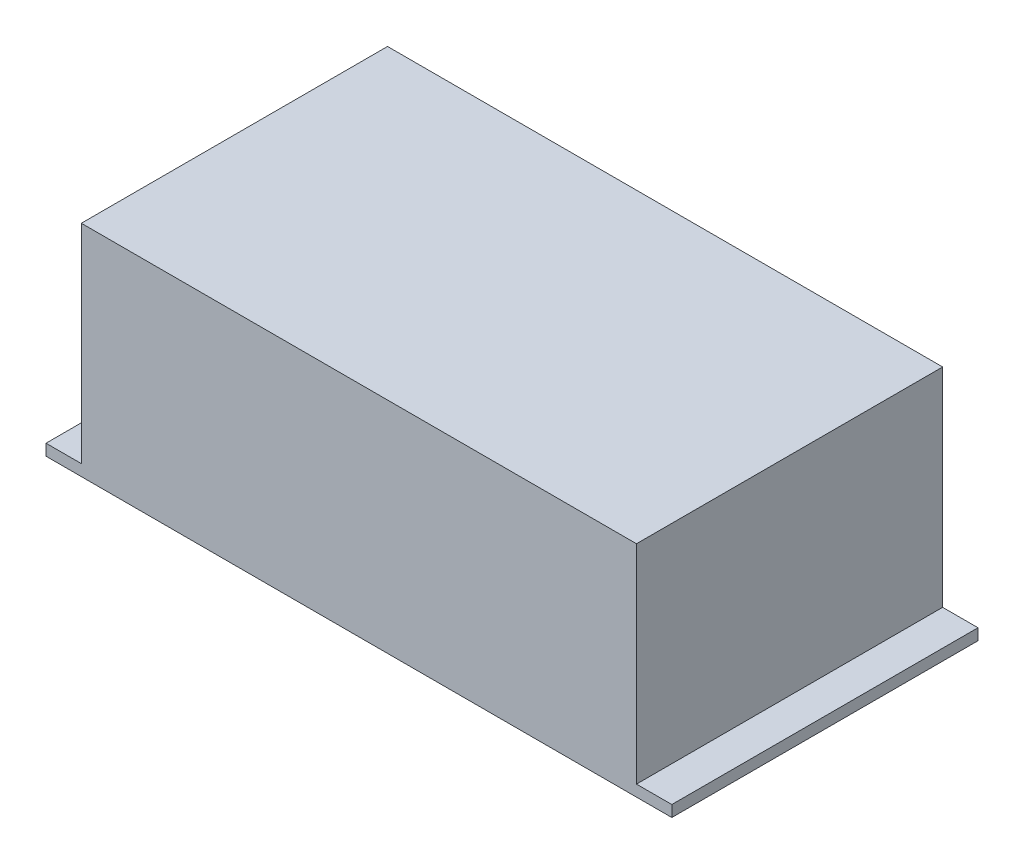
from build123d import *

# Parameters (mm, degrees)
SKETCH1_W           = 72.15
SKETCH1_H           = 35.3
BOSS_EXTRUDE1_DEPTH = 1.3
SKETCH2_W           = 64
SKETCH2_H           = 35.3
BOSS_EXTRUDE2_DEPTH = 24


with BuildPart() as part:
    # Sketch1 → Boss-Extrude1 (new body)
    with BuildSketch(Plane(origin=(0, 0, 0), x_dir=(1, 0, 0), z_dir=(0, 1, 0))):
        with Locations((36.075, -17.65)):
            Rectangle(SKETCH1_W, SKETCH1_H)
    extrude(amount=BOSS_EXTRUDE1_DEPTH)

    # Sketch2 → Boss-Extrude2 (add)
    with BuildSketch(Plane(origin=(0, 1.3, 0), x_dir=(1, 0, 0), z_dir=(0, 1, 0))):
        with Locations((36.075, -17.65)):
            Rectangle(SKETCH2_W, SKETCH2_H)
    extrude(amount=BOSS_EXTRUDE2_DEPTH)


solid = part.part
